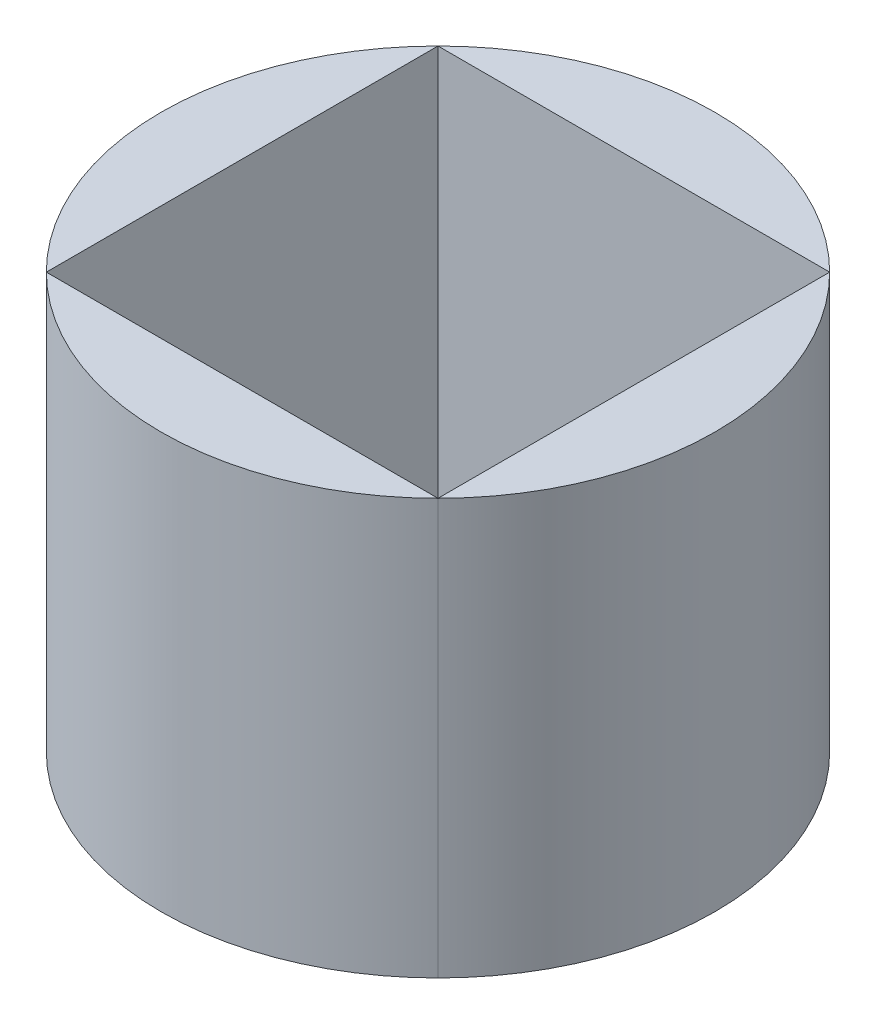
from build123d import *

# Parameters (mm, degrees)
BOSS_EXTRUDE1_DEPTH   = 3
BOSS_EXTRUDE1_2_DEPTH = 3
BOSS_EXTRUDE1_3_DEPTH = 3
BOSS_EXTRUDE1_4_DEPTH = 3


with BuildPart() as part:
    # Sketch1 → Boss-Extrude1 (new body)
    with BuildSketch(Plane(origin=(0, 0, 0), x_dir=(1, 0, 0), z_dir=(0, 1, 0))):
        with BuildLine():
            ThreePointArc((1.414213562, 1.414213562), (0, 2), (-1.414213562, 1.414213562))
            Line((-1.414213562, 1.414213562), (1.414213562, 1.414213562))
        make_face()
    extrude(amount=BOSS_EXTRUDE1_DEPTH)


with BuildPart() as body_2:
    # Sketch1 → Boss-Extrude1 2 (new body)
    with BuildSketch(Plane(origin=(0, 0, 0), x_dir=(1, 0, 0), z_dir=(0, 1, 0))):
        with BuildLine():
            Line((1.414213562, 1.414213562), (1.414213562, -1.414213562))
            ThreePointArc((1.414213562, -1.414213562), (1.847759065, -0.765366865), (2, 0))
            ThreePointArc((2, 0), (1.847759065, 0.765366865), (1.414213562, 1.414213562))
        make_face()
    extrude(amount=BOSS_EXTRUDE1_2_DEPTH)


with BuildPart() as body_3:
    # Sketch1 → Boss-Extrude1 3 (new body)
    with BuildSketch(Plane(origin=(0, 0, 0), x_dir=(1, 0, 0), z_dir=(0, 1, 0))):
        with BuildLine():
            Line((1.414213562, -1.414213562), (-1.414213562, -1.414213562))
            ThreePointArc((-1.414213562, -1.414213562), (0, -2), (1.414213562, -1.414213562))
        make_face()
    extrude(amount=BOSS_EXTRUDE1_3_DEPTH)


with BuildPart() as body_4:
    # Sketch1 → Boss-Extrude1 4 (new body)
    with BuildSketch(Plane(origin=(0, 0, 0), x_dir=(1, 0, 0), z_dir=(0, 1, 0))):
        with BuildLine():
            ThreePointArc((-1.414213562, 1.414213562), (-2, 0), (-1.414213562, -1.414213562))
            Line((-1.414213562, -1.414213562), (-1.414213562, 1.414213562))
        make_face()
    extrude(amount=BOSS_EXTRUDE1_4_DEPTH)


solid = Compound([part.part, body_2.part, body_3.part, body_4.part])
